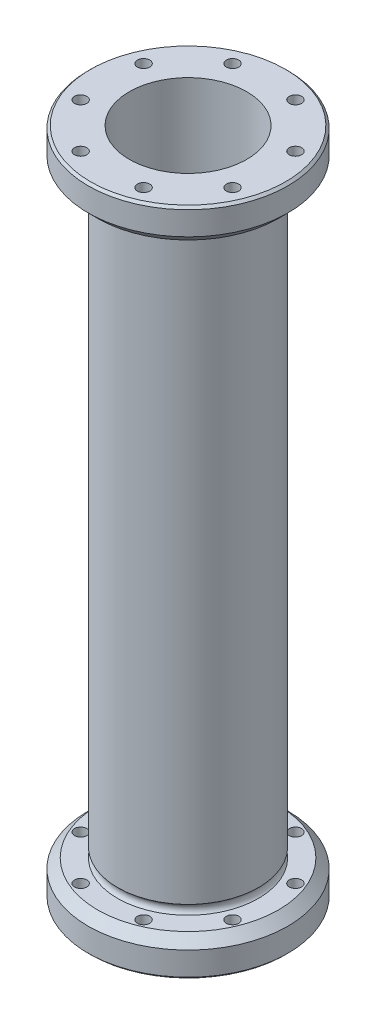
from build123d import *

# Parameters (mm, degrees)
M12X1_5_1_D              = 10.5
PATTERN_CIRCULAR_1_COUNT = 8
CHAMFER_1_SIZE           = 8
CHAMFER_2_SIZE           = 2


with BuildPart() as part:
    # 草圖1 → 旋轉1 (revolve)
    with BuildSketch(Plane.XY, mode=Mode.PRIVATE) as revolve_1_sk:
        Polygon((50, 0), (85, 0), (85, 30), (60, 30), (60, 540), (85, 540), (85, 570), (50, 570), align=None)
    revolve(revolve_1_sk.sketch.rotate(Axis((0, -1001.13524313, 0), (0, 1, 0)), 90), axis=Axis((0, -1001.13524313, 0), (0, 1, 0)))

    # 草圖2 → 除料-旋轉1 (revolve, cut)
    with BuildSketch(Plane.XY, mode=Mode.PRIVATE) as cut_revolve_1_sk:
        with BuildLine():
            Line((60, 540), (60, 532))
            ThreePointArc((60, 532), (58, 536), (60, 540))
        make_face()
        with BuildLine():
            Line((60, 38), (60, 30))
            ThreePointArc((60, 30), (58, 34), (60, 38))
        make_face()
    revolve(cut_revolve_1_sk.sketch.rotate(Axis((0, -1001.13524313, 0), (0, -1, 0)), 90), axis=Axis((0, -1001.13524313, 0), (0, -1, 0)), mode=Mode.SUBTRACT)

    # M12x1.5 螺紋孔1 (through all)
    with Locations(Plane.XZ):
        with Locations((-64.671567276, 26.787840266)):
            m12x1_5_1 = Hole(M12X1_5_1_D / 2)

    # 環狀複製排列1: M12x1.5 螺紋孔1 ×8 about axis
    pattern_circular_1_axis = Axis((0, 0, 0), (0, 1, 0))
    for i in range(1, PATTERN_CIRCULAR_1_COUNT):
        add(m12x1_5_1.rotate(pattern_circular_1_axis, i * 360 / PATTERN_CIRCULAR_1_COUNT), mode=Mode.SUBTRACT)

    # 導角1
    chamfer_1_edges = [part.edges().sort_by_distance(p)[0] for p in [
        (0, 540, 85),
        (0, 30, 85),
    ]]
    chamfer(chamfer_1_edges, length=CHAMFER_1_SIZE)

    # 導角2
    chamfer_2_edges = [part.edges().sort_by_distance(p)[0] for p in [
        (0, 570, 85),
        (0, 0, 85),
    ]]
    chamfer(chamfer_2_edges, length=CHAMFER_2_SIZE)


solid = part.part
